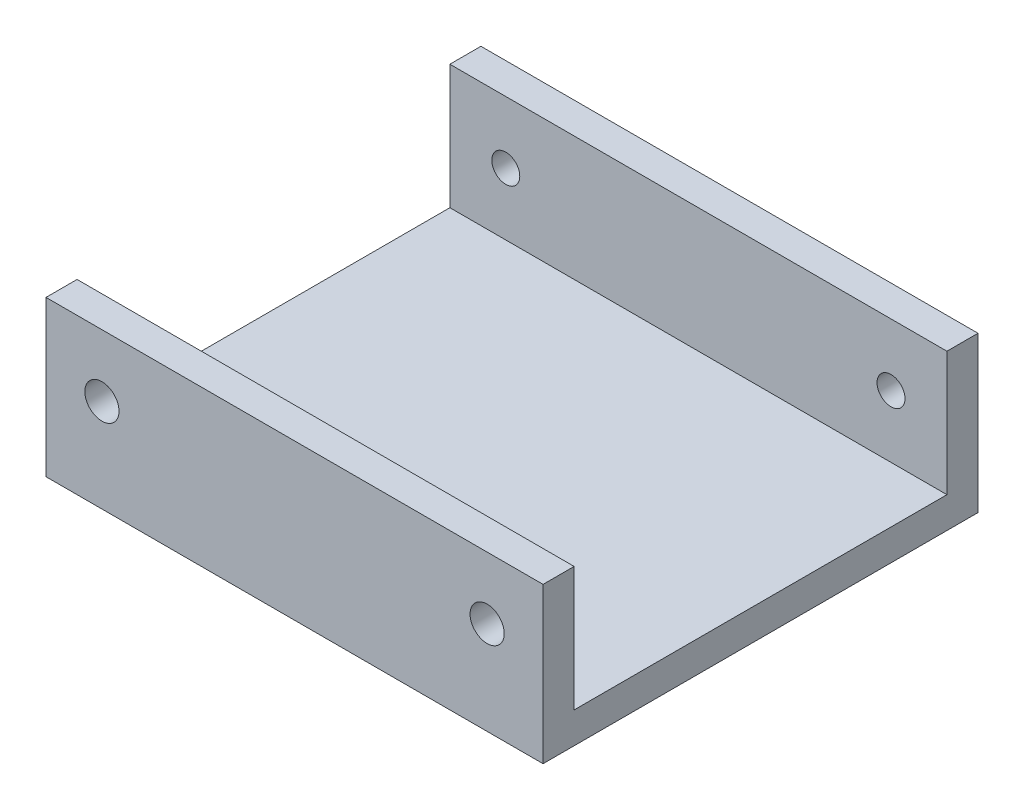
from build123d import *

# Parameters (mm, degrees)
SKETCH1_W           = 80
SKETCH1_H           = 20
SKETCH1_R           = 2.25
BOSS_EXTRUDE1_DEPTH = 5
SKETCH2_W           = 80
SKETCH2_H           = 70
BOSS_EXTRUDE2_DEPTH = 5
SKETCH3_W           = 80
SKETCH3_H           = 20
SKETCH3_R           = 2.75
BOSS_EXTRUDE3_DEPTH = 5


with BuildPart() as part:
    # Sketch1 → Boss-Extrude1 (new body)
    with BuildSketch(Plane.XY):
        with Locations((40, 10)):
            Rectangle(SKETCH1_W, SKETCH1_H)
        with Locations((9, 10)):
            Circle(SKETCH1_R, mode=Mode.SUBTRACT)
        with Locations(Location((71, 10, 0), (0, 0, 180))):
            Circle(SKETCH1_R, mode=Mode.SUBTRACT)
    extrude(amount=BOSS_EXTRUDE1_DEPTH)

    # Sketch2 → Boss-Extrude2 (add)
    with BuildSketch(Plane.XZ):
        with Locations((40, 35)):
            Rectangle(SKETCH2_W, SKETCH2_H)
    extrude(amount=BOSS_EXTRUDE2_DEPTH)

    # Sketch3 → Boss-Extrude3 (add)
    with BuildSketch(Plane.XY.offset(70)):
        with Locations((40, 10)):
            Rectangle(SKETCH3_W, SKETCH3_H)
        with Locations((9, 10)):
            Circle(SKETCH3_R, mode=Mode.SUBTRACT)
        with Locations(Location((71, 10, 0), (0, 0, 180))):
            Circle(SKETCH3_R, mode=Mode.SUBTRACT)
    extrude(amount=-BOSS_EXTRUDE3_DEPTH)


solid = part.part
